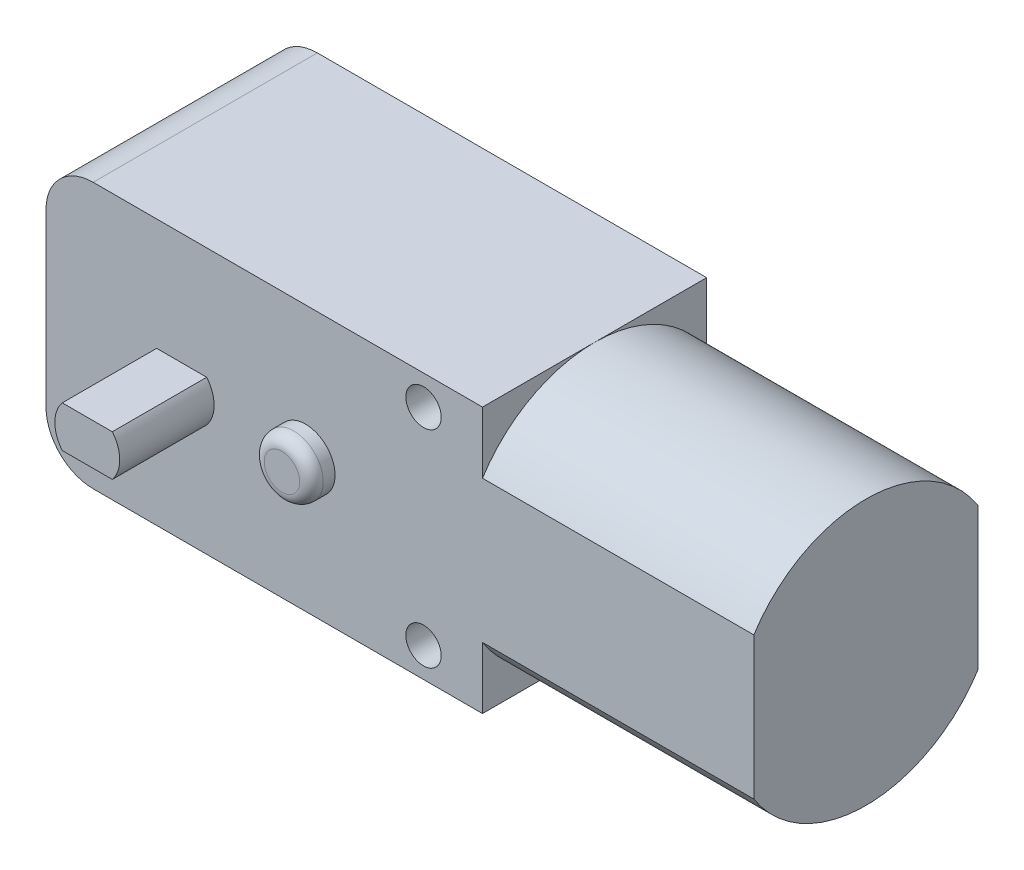
from build123d import *

# Parameters (mm, degrees)
BOSS_EXTRUDE1_DEPTH = 19
BOSS_EXTRUDE2_DEPTH = 23
BOSS_EXTRUDE3_DEPTH = 8
SKETCH4_R           = 2.5
BOSS_EXTRUDE4_DEPTH = 2
FILLET1_R           = 1
SKETCH5_R           = 1.5
CUT_EXTRUDE1_DEPTH  = 48.008642822


with BuildPart() as part:
    # Sketch1 → Boss-Extrude1 (new body)
    with BuildSketch(Plane.XY):
        with BuildLine():
            Line((-14.5, 11.25), (18.5, 11.25))
            Line((18.5, 11.25), (18.5, -11.25))
            Line((18.5, -11.25), (-14.5, -11.25))
            ThreePointArc((-14.5, -11.25), (-17.328427125, -10.078427125), (-18.5, -7.25))
            Line((-18.5, -7.25), (-18.5, 7.25))
            ThreePointArc((-18.5, 7.25), (-17.328427125, 10.078427125), (-14.5, 11.25))
        make_face()
    extrude(amount=BOSS_EXTRUDE1_DEPTH)

    # Sketch2 → Boss-Extrude2 (add)
    with BuildSketch(Plane(origin=(18.5, 0, 0), x_dir=(0, 0, -1), z_dir=(1, 0, 0))):
        with BuildLine():
            Line((-19, 6.025985397), (-19, -6.025985397))
            ThreePointArc((-19, -6.025985397), (-9.5, -11.25), (0, -6.025985397))
            Line((0, -6.025985397), (0, 6.025985397))
            ThreePointArc((0, 6.025985397), (-9.5, 11.25), (-19, 6.025985397))
        make_face()
    extrude(amount=BOSS_EXTRUDE2_DEPTH)

    # Sketch3 → Boss-Extrude3 (add)
    with BuildSketch(Plane.XY.offset(19)):
        with BuildLine():
            Line((-9.121320344, 1.75), (-4.878679656, 1.75))
            ThreePointArc((-4.878679656, 1.75), (-4.25, 0), (-4.878679656, -1.75))
            Line((-4.878679656, -1.75), (-9.121320344, -1.75))
            ThreePointArc((-9.121320344, -1.75), (-9.75, 0), (-9.121320344, 1.75))
        make_face()
    extrude(amount=BOSS_EXTRUDE3_DEPTH)

    # Sketch4 → Boss-Extrude4 (add)
    with BuildSketch(Plane.XY.offset(19)):
        with Locations((3.5, 0)):
            Circle(SKETCH4_R)
    extrude(amount=BOSS_EXTRUDE4_DEPTH)

    # Fillet1
    fillet1_edges = [part.edges().sort_by_distance(p)[0] for p in [
        (1, 0, 21),
    ]]
    fillet(fillet1_edges, radius=FILLET1_R)

    # Sketch5 → Cut-Extrude1 (cut, through all)
    with BuildSketch(Plane.XY.offset(19)):
        with Locations((13.5, 8.75)):
            Circle(SKETCH5_R)
        with Locations((13.5, -8.75)):
            Circle(SKETCH5_R)
    extrude(amount=-CUT_EXTRUDE1_DEPTH, mode=Mode.SUBTRACT)


solid = part.part
